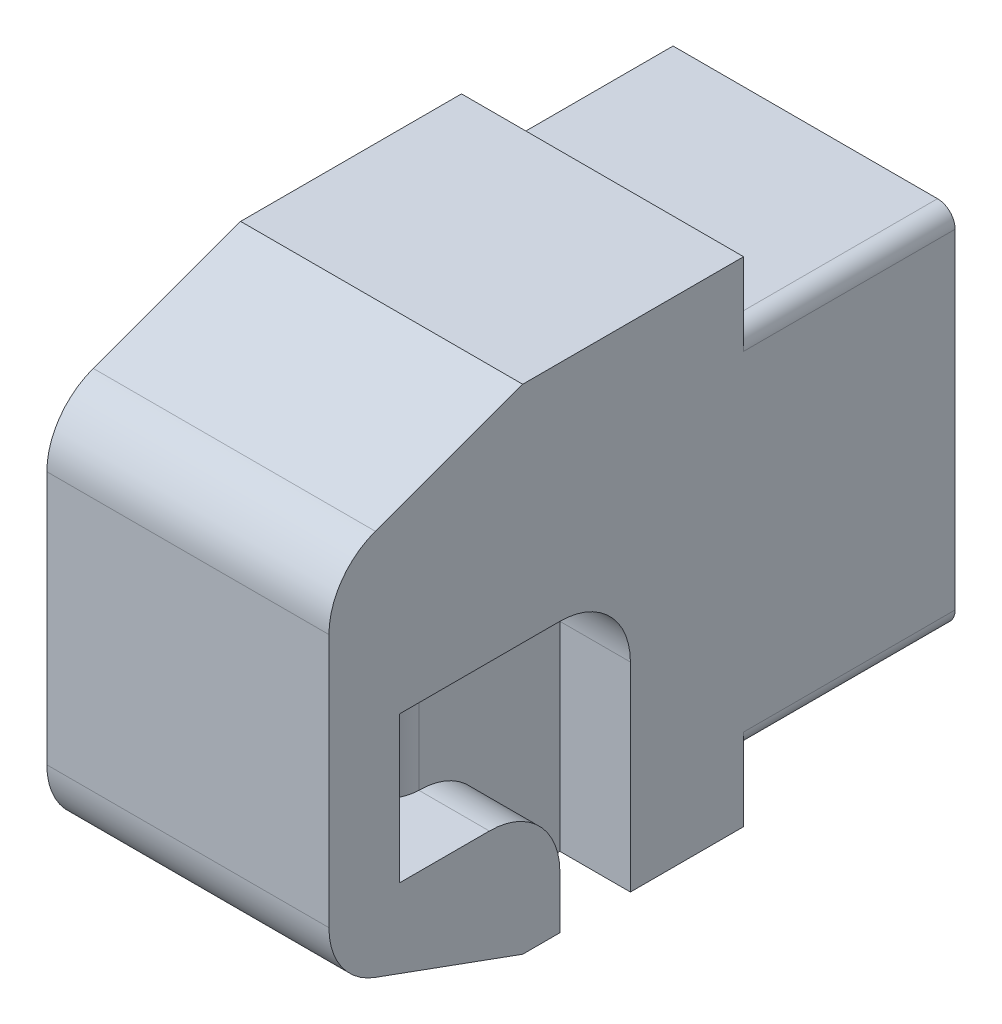
from build123d import *

# Parameters (mm, degrees)
SKETCH1_W           = 8
SKETCH1_H           = 10.35
BOSS_EXTRUDE1_DEPTH = 6
SKETCH2_W           = 8
SKETCH2_H           = 14
BOSS_EXTRUDE2_DEPTH = 11.76
SKETCH3_W           = 1.55
SKETCH3_H           = 4.15
CUT_EXTRUDE1_DEPTH  = 6
CUT_EXTRUDE2_DEPTH  = 2
CHAMFER1_SIZE       = 2
CHAMFER1_SIZE2      = 5.494954839
FILLET1_R           = 2
FILLET2_R           = 2
FILLET3_R           = 1
FILLET5_R           = 0.5


with BuildPart() as part:
    # Sketch1 → Boss-Extrude1 (new body)
    with BuildSketch(Plane.XY):
        with Locations((4, 5.175)):
            Rectangle(SKETCH1_W, SKETCH1_H)
    extrude(amount=BOSS_EXTRUDE1_DEPTH)

    # Sketch2 → Boss-Extrude2 (add)
    with BuildSketch(Plane.XY.offset(6)):
        with Locations((4, 5.175)):
            Rectangle(SKETCH2_W, SKETCH2_H)
    extrude(amount=BOSS_EXTRUDE2_DEPTH)

    # Sketch3 → Cut-Extrude1 (cut)
    with BuildSketch(Plane(origin=(8, 0, 0), x_dir=(0, 0, -1), z_dir=(1, 0, 0))):
        with Locations((-14.985, 3.75)):
            Rectangle(SKETCH3_W, SKETCH3_H)
    extrude(amount=-CUT_EXTRUDE1_DEPTH, mode=Mode.SUBTRACT)

    # Sketch4 → Cut-Extrude2 (cut)
    with BuildSketch(Plane(origin=(8, 0, 0), x_dir=(0, 0, -1), z_dir=(1, 0, 0))):
        Polygon((-14.21, 1.675), (-11.21, 1.675), (-11.21, -1.825), (-9.21, -1.825), (-9.21, 5.825), (-14.21, 5.825), align=None)
    extrude(amount=-CUT_EXTRUDE2_DEPTH, mode=Mode.SUBTRACT)

    # Chamfer1
    chamfer1_edges = [part.edges().sort_by_distance(p)[0] for p in [
        (4, -1.825, 17.76),
        (4, 12.175, 17.76),
    ]]
    chamfer1_side = [part.faces().sort_by_distance(p)[0] for p in [
        (4, 5.175, 17.76),
    ]]
    chamfer(chamfer1_edges, length=CHAMFER1_SIZE, length2=CHAMFER1_SIZE2, reference=chamfer1_side[0])

    # Fillet1
    fillet1_edges = [part.edges().sort_by_distance(p)[0] for p in [
        (4, 0.175, 17.76),
        (4, 10.175, 17.76),
    ]]
    fillet(fillet1_edges, radius=FILLET1_R)

    # Fillet2
    fillet2_edges = [part.edges().sort_by_distance(p)[0] for p in [
        (7, 5.825, 9.21),
        (7, 1.675, 11.21),
    ]]
    fillet(fillet2_edges, radius=FILLET2_R)

    # Fillet3
    fillet3_edges = [part.edges().sort_by_distance(p)[0] for p in [
        (6, 3.75, 14.21),
    ]]
    fillet(fillet3_edges, radius=FILLET3_R)

    # Fillet5
    fillet5_edges = [part.edges().sort_by_distance(p)[0] for p in [
        (8, 10.35, 3),
        (8, 0, 3),
    ]]
    fillet(fillet5_edges, radius=FILLET5_R)


solid = part.part
